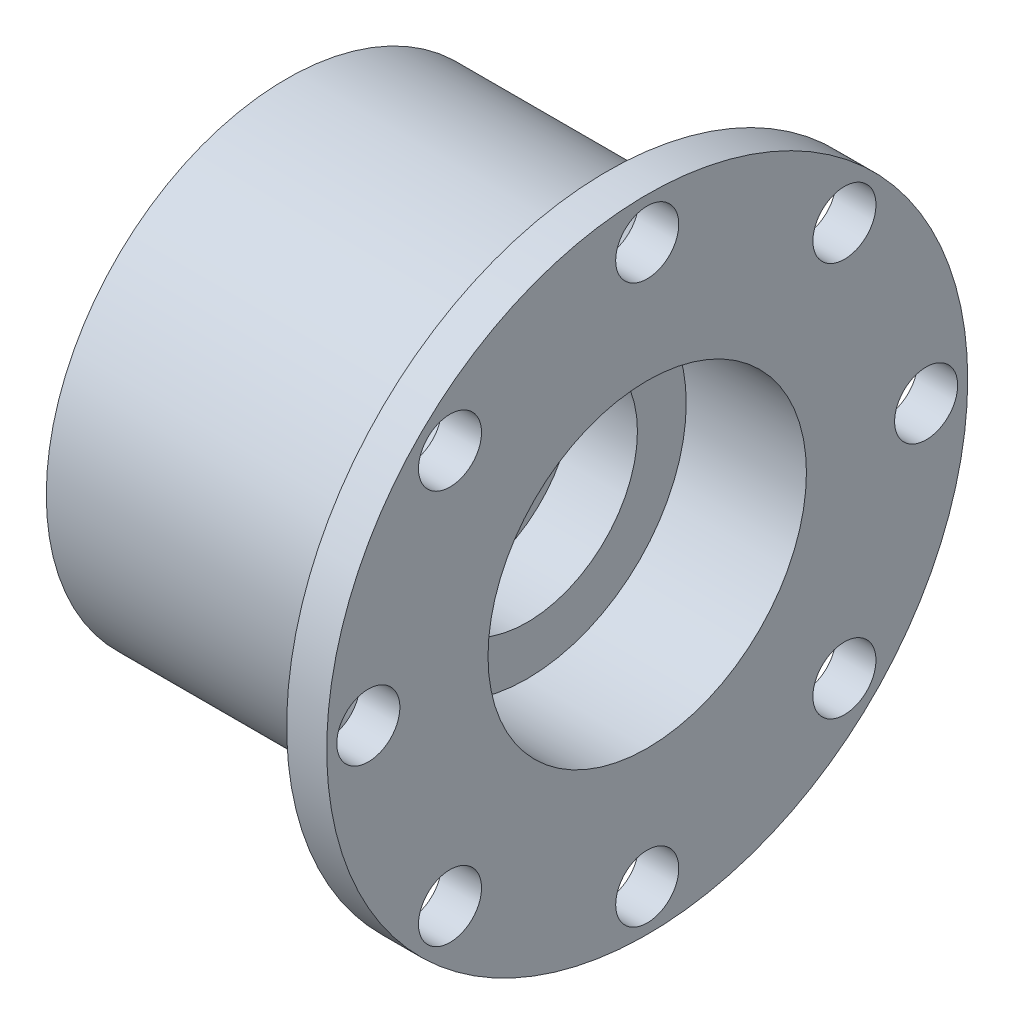
from build123d import *

# Parameters (mm, degrees)
SKETCH1_R              = 38.1
BOSS_EXTRUDE1_DEPTH    = 38.1
SKETCH2_R              = 17.5
CUT_EXTRUDE1_DEPTH     = 10.25
F_25_0MM_DOWEL_HOLE1_D = 17
SKETCH14_R             = 38.1
SKETCH14_R_2           = 25.235346295
BOSS_EXTRUDE3_DEPTH    = 19.05
BOSS_EXTRUDE2_START    = -6.35
SKETCH7_R              = 50.8
SKETCH7_R_2            = 25.235346295
BOSS_EXTRUDE2_DEPTH    = 6.35
SKETCH8_R              = 20
CUT_EXTRUDE2_DEPTH     = 13
M8_CLEARANCE_HOLE1_D   = 10


with BuildPart() as part:
    # Sketch1 → Boss-Extrude1 (new body)
    with BuildSketch(Plane(origin=(0, 0, 0), x_dir=(0, 0, -1), z_dir=(1, 0, 0))):
        with Locations(Location((0, 0, 0), (0, 0, 180))):
            Circle(SKETCH1_R)
    extrude(amount=BOSS_EXTRUDE1_DEPTH)

    # Sketch2 → Cut-Extrude1 (cut)
    with BuildSketch(Plane(origin=(38.1, 0, 0), x_dir=(0, 0, -1), z_dir=(1, 0, 0))):
        Circle(SKETCH2_R)
    extrude(amount=-CUT_EXTRUDE1_DEPTH, mode=Mode.SUBTRACT)

    # Ø25.0mm Dowel Hole1 (through all)
    with Locations(Plane(origin=(27.85, 0, 0), x_dir=(0, 0, -1), z_dir=(1, 0, 0))):
        with Locations((0, 0)):
            Hole(F_25_0MM_DOWEL_HOLE1_D / 2)

    # Sketch14 → Boss-Extrude3 (add)
    with BuildSketch(Plane(origin=(38.1, 0, 0), x_dir=(0, 0, -1), z_dir=(1, 0, 0))):
        with Locations(Location((0, 0, 0), (0, 0, 180))):
            Circle(SKETCH14_R)
        with Locations(Location((0, 0, 0), (0, 0, 180))):
            Circle(SKETCH14_R_2, mode=Mode.SUBTRACT)
    extrude(amount=BOSS_EXTRUDE3_DEPTH)

    # Sketch7 → Boss-Extrude2 (add)
    with BuildSketch(Plane(origin=(57.15, 0, 0), x_dir=(0, 0, -1), z_dir=(1, 0, 0)).offset(BOSS_EXTRUDE2_START)):
        Circle(SKETCH7_R)
        with Locations(Location((0, 0, 0), (0, 0, 180))):
            Circle(SKETCH7_R_2, mode=Mode.SUBTRACT)
    extrude(amount=BOSS_EXTRUDE2_DEPTH)

    # Sketch8 → Cut-Extrude2 (cut)
    with BuildSketch(Plane.ZY):
        Circle(SKETCH8_R)
    extrude(amount=-CUT_EXTRUDE2_DEPTH, mode=Mode.SUBTRACT)

    # M8 Clearance Hole1 (through all)
    with Locations(Plane.ZY.offset(-50.8)):
        with Locations((-44.206688043, 0), (-31.258848889, 31.258848889), (0, 44.206688043), (31.258848889, 31.258848889), (44.206688043, 0), (31.258848889, -31.258848889), (0, -44.206688043), (-31.258848889, -31.258848889), (0, 0)):
            Hole(M8_CLEARANCE_HOLE1_D / 2)


solid = part.part
